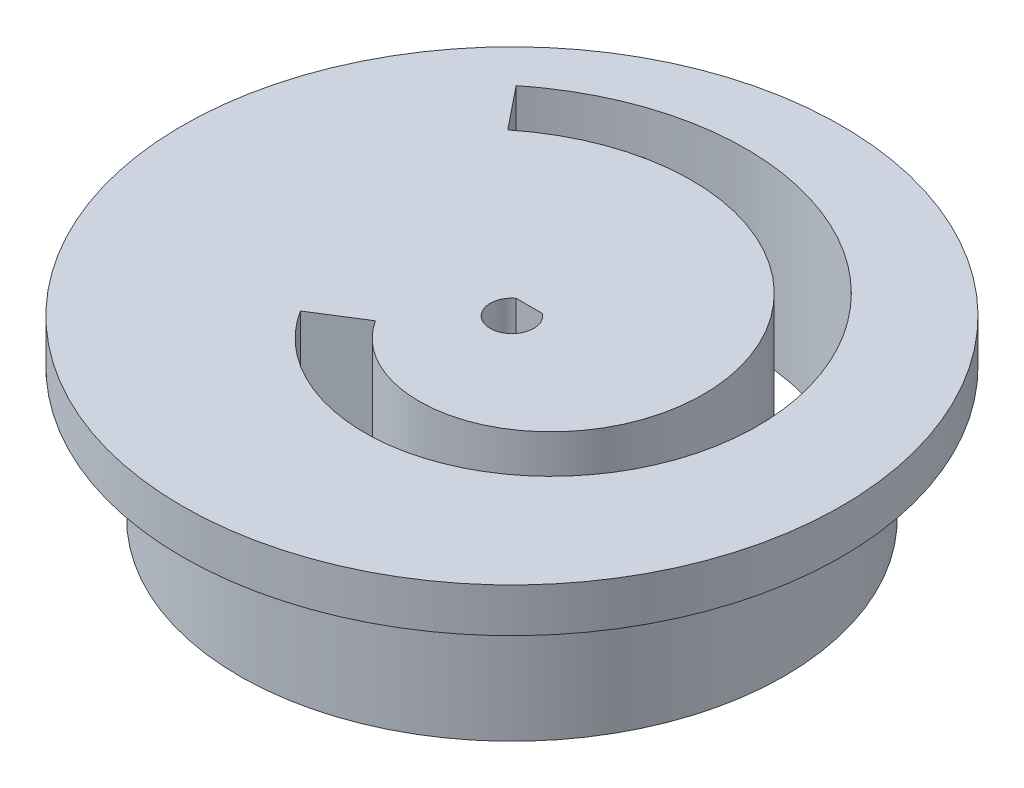
from build123d import *

# Parameters (mm, degrees)
SKETCH1_R           = 37.5
BOSS_EXTRUDE1_DEPTH = 5
SKETCH10_R          = 31
BOSS_EXTRUDE2_DEPTH = 15
CUT_EXTRUDE1_DEPTH  = 57.678920244
CUT_EXTRUDE2_DEPTH  = 57.678920244


with BuildPart() as part:
    # Sketch1 → Boss-Extrude1 (new body)
    with BuildSketch(Plane(origin=(0, 0, 0), x_dir=(1, 0, 0), z_dir=(0, 1, 0))):
        Circle(SKETCH1_R)
    extrude(amount=BOSS_EXTRUDE1_DEPTH)

    # Sketch10 → Boss-Extrude2 (add)
    with BuildSketch(Plane.XZ):
        Circle(SKETCH10_R)
    extrude(amount=BOSS_EXTRUDE2_DEPTH)

    # Sketch11 → Cut-Extrude1 (cut, through all)
    with BuildSketch(Plane.XZ.offset(15)):
        with BuildLine():
            Line((1.491643389, -1.975), (-1.491643389, -1.975))
            ThreePointArc((-1.491643389, -1.975), (0, 2.475), (1.491643389, -1.975))
        make_face()
    extrude(amount=-CUT_EXTRUDE1_DEPTH, mode=Mode.SUBTRACT)

    # Sketch12 → Cut-Extrude2 (cut, through all)
    with BuildSketch(Plane(origin=(0, 5, 0), x_dir=(1, 0, 0), z_dir=(0, 1, 0))):
        with BuildLine():
            Line((-12.522960402, -11.550987883), (-7.276029472, -8.24800199))
            add(Edge.make_bspline(
                [(-18.566317366, 18.087986584), (-16.574063082, 19.6861494), (-14.373261885, 20.959086767), (-9.79610982, 22.776270096), (-7.408671534, 23.325251613), (-2.682384051, 23.701949314), (-0.331512749, 23.530934674), (4.117390892, 22.54012868), (6.227320203, 21.718005169), (10.027759886, 19.551591543), (11.728984463, 18.201550208), (14.596266579, 15.14457286), (15.770893072, 13.428953103), (17.527571222, 9.826499131), (18.115264822, 7.92879983), (18.700426824, 4.149147995), (18.700079831, 2.255101797), (18.166772453, -1.34708247), (17.632310064, -3.067469712), (16.13399267, -6.184277521), (15.165044903, -7.59200202), (12.933009073, -9.988675008), (11.661654701, -10.986949869), (8.976160145, -12.519251352), (7.551287211, -13.059754313), (4.709672005, -13.681053825), (3.280670849, -13.764842942), (0.565855338, -13.522749206), (-0.732647761, -13.196039768), (-3.080034254, -12.219492133), (-4.140875366, -11.565006492), (-5.944027576, -10.043678404), (-6.69667503, -9.168330698), (-7.276029472, -8.24800199)],
                knots=[0, 0, 0, 0, 0.0625, 0.0625, 0.125, 0.125, 0.1875, 0.1875, 0.25, 0.25, 0.3125, 0.3125, 0.375, 0.375, 0.4375, 0.4375, 0.5, 0.5, 0.5625, 0.5625, 0.625, 0.625, 0.6875, 0.6875, 0.75, 0.75, 0.8125, 0.8125, 0.875, 0.875, 0.9375, 0.9375, 1, 1, 1, 1], degree=3))
            Line((-18.566317366, 18.087986584), (-22.445875943, 22.924206724))
            add(Edge.make_bspline(
                [(-22.445875943, 22.924206724), (-19.969825826, 24.910464833), (-17.237941121, 26.492521157), (-11.506970883, 28.767783903), (-8.520553945, 29.456293243), (-2.555690408, 29.931708754), (0.409277257, 29.717850527), (6.07214005, 28.456686238), (8.756936396, 27.412613765), (13.639010184, 24.629622306), (15.824727512, 22.897648426), (19.54476833, 18.931495095), (21.070095492, 16.707358252), (23.373848964, 11.983006302), (24.146644363, 9.49504246), (24.923059123, 4.480059499), (24.924920169, 1.966413332), (24.208227547, -2.874432658), (23.491955176, -5.18832883), (21.450084705, -9.435838641), (20.130617856, -11.357409493), (17.041692734, -14.674176771), (15.281683474, -16.059679472), (11.501399671, -18.216650696), (9.493060749, -18.981663836), (5.416503734, -19.872974834), (3.361647035, -19.996666952), (-0.616520536, -19.641913768), (-2.526245675, -19.164989771), (-6.049307758, -17.699343634), (-7.65007538, -16.716185155), (-10.430976704, -14.369925494), (-11.600495296, -13.016362199), (-12.522960402, -11.550987883)],
                knots=[0, 0, 0, 0, 0.0625, 0.0625, 0.125, 0.125, 0.1875, 0.1875, 0.25, 0.25, 0.3125, 0.3125, 0.375, 0.375, 0.4375, 0.4375, 0.5, 0.5, 0.5625, 0.5625, 0.625, 0.625, 0.6875, 0.6875, 0.75, 0.75, 0.8125, 0.8125, 0.875, 0.875, 0.9375, 0.9375, 1, 1, 1, 1], degree=3))
        make_face()
    extrude(amount=-CUT_EXTRUDE2_DEPTH, mode=Mode.SUBTRACT)


solid = part.part
